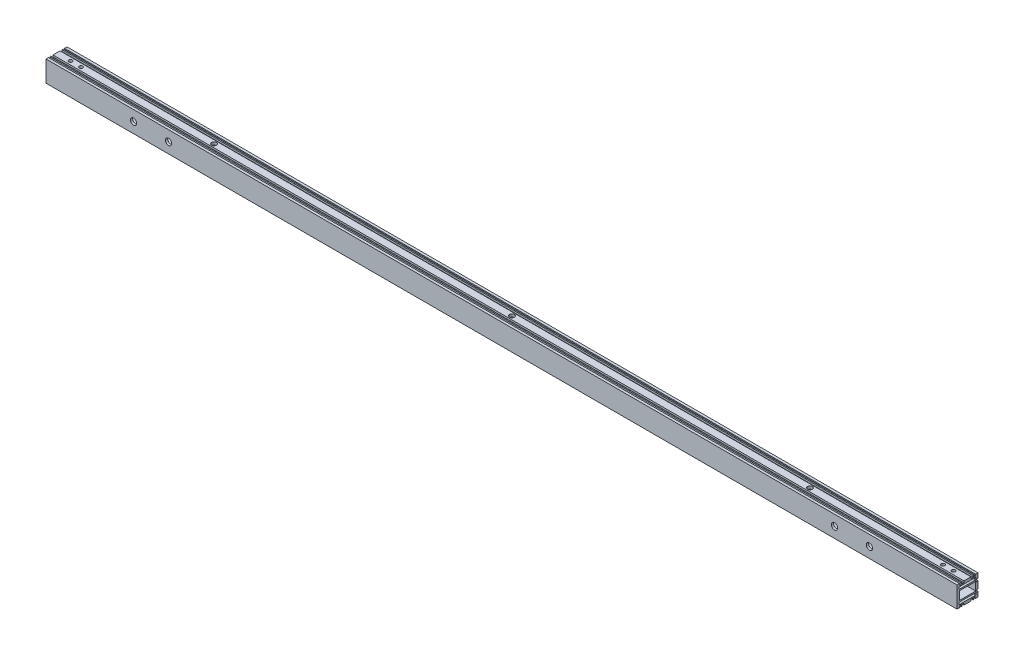
from build123d import *

# Parameters (mm, degrees)
SKETCH_1_W                = 23.5
SKETCH_1_H                = 12
EXTRUDE_1_DEPTH           = 650.5
HOLE_WIZARD_M6_1_D        = 5
HOLE_WIZARD_M6_1_DEPTH    = 19
HOLE_WIZARD_M6_1_TIP      = 1.502151548
HOLE_WIZARD_M6_2_D        = 5
HOLE_WIZARD_M6_2_DEPTH    = 19
HOLE_WIZARD_M6_2_TIP      = 1.502151548
HOLE_WIZARD_9_0_9_1_D     = 9
HOLE_WIZARD_M6_3_D        = 5
HOLE_WIZARD_M6_3_DEPTH    = 15
HOLE_WIZARD_M6_3_TIP      = 1.502151548
HOLE_WIZARD_7_0_7_1_D     = 7
HOLE_WIZARD_7_0_7_1_DEPTH = 15
HOLE_WIZARD_7_0_7_1_TIP   = 2.103012167


with BuildPart() as part:
    # 草图1 → 凸台-拉伸1 (new, symmetric)
    with BuildSketch(Plane(origin=(0, 0, 0), x_dir=(0, 0, -1), z_dir=(1, 0, 0))):
        Polygon((-15, 15), (-11.5, 15), (-11.5, 13.5), (-11, 13.5), (-11, 12), (-9.5, 12), (-9.5, 15), (-8, 15), (-8, 12.5), (-5, 12.5), (-5, 15), (5, 15), (5, 12.5), (8, 12.5), (8, 15), (9.5, 15), (9.5, 12), (11, 12), (11, 13.5), (11.5, 13.5), (11.5, 15), (15, 15), (15, 8), (12.5, 8), (12.5, 5), (15, 5), (15, -5), (12.5, -5), (12.5, -8), (15, -8), (15, -15), (11.5, -15), (11.5, -13.5), (11, -13.5), (11, -12), (9.5, -12), (9.5, -15), (8, -15), (8, -12.5), (5, -12.5), (5, -15), (-5, -15), (-5, -12.5), (-8, -12.5), (-8, -15), (-9.5, -15), (-9.5, -12), (-11, -12), (-11, -13.5), (-11.5, -13.5), (-11.5, -15), (-15, -15), align=None)
        with BuildLine():
            Line((12, -10.5), (12, -8.5))
            ThreePointArc((12, -8.5), (11.853553391, -8.146446609), (11.5, -8))
            Line((11.5, -8), (-11.5, -8))
            ThreePointArc((-11.5, -8), (-11.853553391, -8.146446609), (-12, -8.5))
            Line((-12, -8.5), (-12, -10.5))
            ThreePointArc((-12, -10.5), (-11.853553391, -10.853553391), (-11.5, -11))
            Line((-11.5, -11), (11.5, -11))
            ThreePointArc((11.5, -11), (11.853553391, -10.853553391), (12, -10.5))
        make_face(mode=Mode.SUBTRACT)
        with BuildLine():
            Line((-11.5, 11), (11.5, 11))
            ThreePointArc((11.5, 11), (11.853553391, 10.853553391), (12, 10.5))
            Line((12, 10.5), (12, 8.5))
            ThreePointArc((12, 8.5), (11.853553391, 8.146446609), (11.5, 8))
            Line((11.5, 8), (-11.5, 8))
            ThreePointArc((-11.5, 8), (-11.853553391, 8.146446609), (-12, 8.5))
            Line((-12, 8.5), (-12, 10.5))
            ThreePointArc((-12, 10.5), (-11.853553391, 10.853553391), (-11.5, 11))
        make_face(mode=Mode.SUBTRACT)
        Rectangle(SKETCH_1_W, SKETCH_1_H, mode=Mode.SUBTRACT)
    extrude(amount=EXTRUDE_1_DEPTH, both=True)

    # M6 螺纹孔1
    with Locations(Plane(origin=(0, 15, 0), x_dir=(1, 0, 0), z_dir=(0, 1, 0))):
        with Locations((630.5, 0), (615.5, 0), (-630.5, 0), (-615.5, 0)):
            Hole(HOLE_WIZARD_M6_1_D / 2, depth=HOLE_WIZARD_M6_1_DEPTH)
            with Locations((0, 0, -(HOLE_WIZARD_M6_1_DEPTH + HOLE_WIZARD_M6_1_TIP / 2))):  # 118° drill point
                Cone(0, HOLE_WIZARD_M6_1_D / 2, HOLE_WIZARD_M6_1_TIP, mode=Mode.SUBTRACT)

    # M6 螺纹孔2
    with Locations(Plane(origin=(0, 0, -15), x_dir=(-1, 0, 0), z_dir=(0, 0, -1))):
        with Locations((-630.5, 0), (-615.5, 0), (615.5, 0), (630.5, 0)):
            Hole(HOLE_WIZARD_M6_2_D / 2, depth=HOLE_WIZARD_M6_2_DEPTH)
            with Locations((0, 0, -(HOLE_WIZARD_M6_2_DEPTH + HOLE_WIZARD_M6_2_TIP / 2))):  # 118° drill point
                Cone(0, HOLE_WIZARD_M6_2_D / 2, HOLE_WIZARD_M6_2_TIP, mode=Mode.SUBTRACT)

    # Ø9.0 (9) 直径孔1 (through all)
    with Locations(Plane.XY.offset(15)):
        with Locations((-525.5, 0), (-475.5, 0), (525.5, 0), (475.5, 0)):
            Hole(HOLE_WIZARD_9_0_9_1_D / 2)

    # M6 螺纹孔3
    with Locations(Plane(origin=(0, -15, 0), x_dir=(-1, 0, 0), z_dir=(0, -1, 0))):
        with Locations((425.5, 0), (0, 0), (-425.5, 0)):
            Hole(HOLE_WIZARD_M6_3_D / 2, depth=HOLE_WIZARD_M6_3_DEPTH)
            with Locations((0, 0, -(HOLE_WIZARD_M6_3_DEPTH + HOLE_WIZARD_M6_3_TIP / 2))):  # 118° drill point
                Cone(0, HOLE_WIZARD_M6_3_D / 2, HOLE_WIZARD_M6_3_TIP, mode=Mode.SUBTRACT)

    # Ø7.0 (7) 直径孔1
    with Locations(Plane(origin=(0, 15, 0), x_dir=(1, 0, 0), z_dir=(0, 1, 0))):
        with Locations((425.5, 0), (0, 0), (-425.5, 0)):
            Hole(HOLE_WIZARD_7_0_7_1_D / 2, depth=HOLE_WIZARD_7_0_7_1_DEPTH)
            with Locations((0, 0, -(HOLE_WIZARD_7_0_7_1_DEPTH + HOLE_WIZARD_7_0_7_1_TIP / 2))):  # 118° drill point
                Cone(0, HOLE_WIZARD_7_0_7_1_D / 2, HOLE_WIZARD_7_0_7_1_TIP, mode=Mode.SUBTRACT)


solid = part.part
